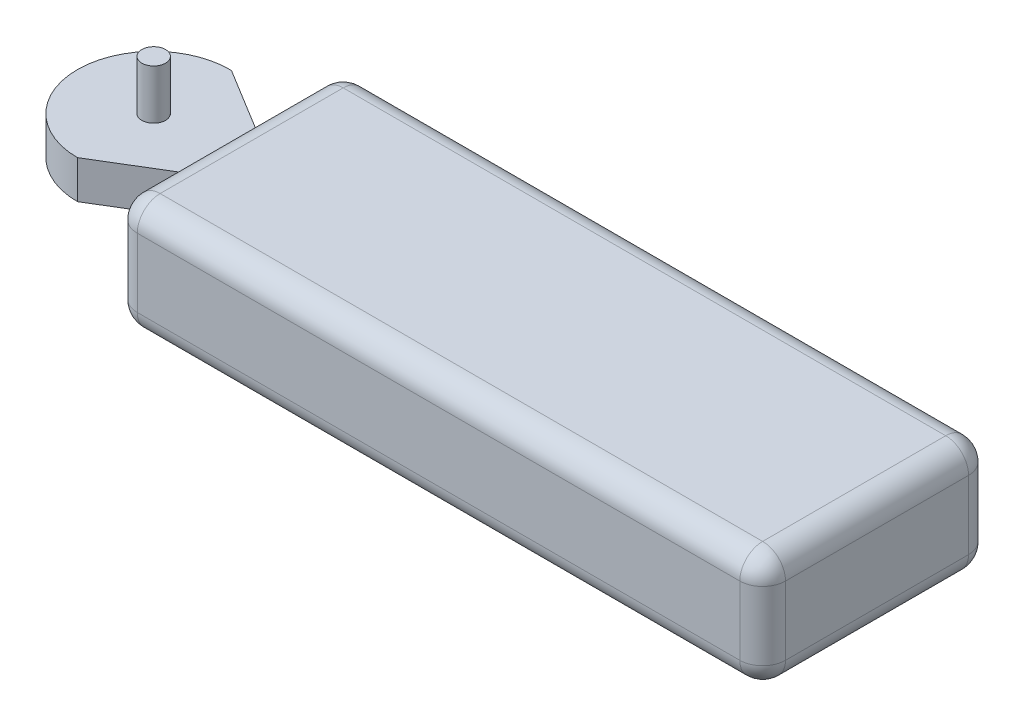
from build123d import *

# Parameters (mm, degrees)
SKETCH1_W                = 20
SKETCH1_H                = 22
BOSS_EXTRUDE1_DEPTH      = 5
BOSS_EXTRUDE2_DEPTH      = 6.5
BOSS_EXTRUDE2_DEPTH_BACK = 11.5
SKETCH2_R                = 1.55
SKETCH8_W                = 30
SKETCH8_H                = 15
BOSS_EXTRUDE3_DEPTH      = 85
FILLET1_R                = 3
FILLET2_R                = 3
FILLET3_R                = 3
FILLET4_R                = 3
FILLET5_R                = 3
FILLET6_R                = 3
CUT_EXTRUDE1_DEPTH       = 20
CUT_EXTRUDE2_DEPTH       = 20


with BuildPart() as part:
    # Sketch1 → Boss-Extrude1 (new body)
    with BuildSketch(Plane(origin=(8.035400608, 0, 0), x_dir=(1, 0, 0), z_dir=(0, 1, 0))):
        with Locations((-13.726235741, 2.992395437)):
            Rectangle(SKETCH1_W, SKETCH1_H)
    extrude(amount=BOSS_EXTRUDE1_DEPTH)

    # Sketch2 → Boss-Extrude2 (add, two sides: drawn at the far end of the back side and taken through both)
    with BuildSketch(Plane(origin=(8.035400608, 5, 0), x_dir=(1, 0, 0), z_dir=(0, 1, 0)).offset(-BOSS_EXTRUDE2_DEPTH_BACK)):
        with Locations((-13.726235741, 2.992395437)):
            Circle(SKETCH2_R)
    extrude(amount=BOSS_EXTRUDE2_DEPTH + BOSS_EXTRUDE2_DEPTH_BACK)

    # Sketch8 → Boss-Extrude3 (add)
    with BuildSketch(Plane(origin=(4.309164866, 0, 0), x_dir=(0, 0, -1), z_dir=(1, 0, 0))):
        with Locations((2.837033874, 1)):
            Rectangle(SKETCH8_W, SKETCH8_H)
    extrude(amount=BOSS_EXTRUDE3_DEPTH)

    # Fillet1
    fillet1_edges = [part.edges().sort_by_distance(p)[0] for p in [
        (46.809164866, -6.5, 12.162966126),
    ]]
    fillet(fillet1_edges, radius=FILLET1_R)

    # Fillet2
    fillet2_edges = [part.edges().sort_by_distance(p)[0] for p in [
        (46.809164866, 8.5, 12.162966126),
    ]]
    fillet(fillet2_edges, radius=FILLET2_R)

    # Fillet3
    fillet3_edges = [part.edges().sort_by_distance(p)[0] for p in [
        (46.809164866, 8.5, -17.837033874),
    ]]
    fillet(fillet3_edges, radius=FILLET3_R)

    # Fillet4
    fillet4_edges = [part.edges().sort_by_distance(p)[0] for p in [
        (46.809164866, -6.5, -17.837033874),
    ]]
    fillet(fillet4_edges, radius=FILLET4_R)

    # Fillet5
    fillet5_edges = [part.edges().sort_by_distance(p)[0] for p in [
        (89.309164866, -6.5, -2.837033874),
    ]]
    fillet(fillet5_edges, radius=FILLET5_R)

    # Fillet6
    fillet6_edges = [part.edges().sort_by_distance(p)[0] for p in [
        (4.309164866, 1, 12.162966126),
    ]]
    fillet(fillet6_edges, radius=FILLET6_R)

    # Sketch7 → Cut-Extrude1 (cut)
    with BuildSketch(Plane(origin=(8.035400608, 11.5, 0), x_dir=(1, 0, 0), z_dir=(0, 1, 0))):
        with BuildLine():
            ThreePointArc((-13.726235741, -7.007604563), (-20.797303553, -4.078672375), (-23.726235741, 2.992395437))
            Line((-23.726235741, 2.992395437), (-23.726235741, -8.007604563))
            Line((-23.726235741, -8.007604563), (-3.820368823, -8.007604563))
            Line((-3.820368823, -8.007604563), (-3.820368823, -1.007604563))
            Line((-3.820368823, -1.007604563), (-13.726235741, -7.007604563))
        make_face()
    extrude(amount=-CUT_EXTRUDE1_DEPTH, mode=Mode.SUBTRACT)

    # Sketch7<4> → Cut-Extrude2 (cut)
    with BuildSketch(Plane(origin=(8.035400608, 11.5, 0), x_dir=(1, 0, 0), z_dir=(0, 1, 0))):
        with BuildLine():
            Line((-23.726235741, 13.992395437), (-23.726235741, 2.992395437))
            ThreePointArc((-23.726235741, 2.992395437), (-20.729612149, 10.130512759), (-13.535691963, 12.990579926))
            Line((-13.535691963, 12.990579926), (-3.756109018, 7.010662038))
            Line((-3.756109018, 7.010662038), (-3.726235741, 13.992395437))
            Line((-3.726235741, 13.992395437), (-23.726235741, 13.992395437))
        make_face()
    extrude(amount=-CUT_EXTRUDE2_DEPTH, mode=Mode.SUBTRACT)


solid = part.part
